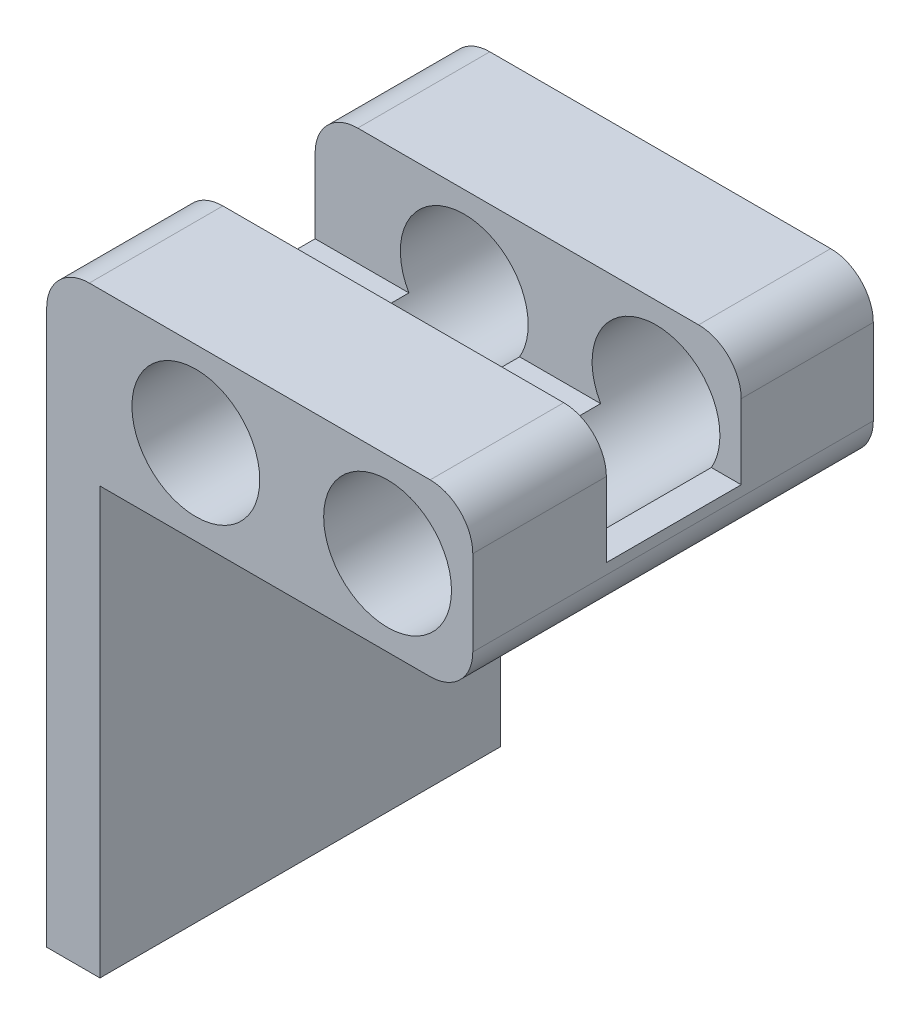
from build123d import *

# Parameters (mm, degrees)
SKETCH1_W               = 23.876
SKETCH1_H               = 25.4
BOSS_EXTRUDE1_DEPTH     = 3.175
SKETCH2_W               = 25.4
SKETCH2_H               = 23.876
BOSS_EXTRUDE2_DEPTH     = 3.175
SKETCH3_W               = 25.4
SKETCH3_H               = 7.9629
SKETCH3_H_2             = 7.874
BOSS_EXTRUDE3_DEPTH     = 6.985
CUT_EXTRUDE1_DEPTH      = 50.796957497
CUT_EXTRUDE1_DEPTH_BACK = 50.796957497
SKETCH4_R               = 3.81
FILLET1_R               = 2.54
FILLET2_R               = 2.54
FILLET3_R               = 2.54


with BuildPart() as part:
    # Sketch1 → Boss-Extrude1 (new body)
    with BuildSketch(Plane(origin=(0, 0, 0), x_dir=(0, 0, -1), z_dir=(1, 0, 0))):
        with Locations((11.938, 12.7)):
            Rectangle(SKETCH1_W, SKETCH1_H)
    extrude(amount=BOSS_EXTRUDE1_DEPTH)

    # Sketch2 → Boss-Extrude2 (add)
    with BuildSketch(Plane(origin=(0, 25.4, 0), x_dir=(1, 0, 0), z_dir=(0, 1, 0))):
        with Locations((12.7, 11.938)):
            Rectangle(SKETCH2_W, SKETCH2_H)
    extrude(amount=BOSS_EXTRUDE2_DEPTH)

    # Sketch3 → Boss-Extrude3 (add)
    with BuildSketch(Plane(origin=(0, 28.575, 0), x_dir=(1, 0, 0), z_dir=(0, 1, 0))):
        with Locations((12.7, 3.98145)):
            Rectangle(SKETCH3_W, SKETCH3_H)
        with Locations((12.7, 19.939)):
            Rectangle(SKETCH3_W, SKETCH3_H_2)
    extrude(amount=BOSS_EXTRUDE3_DEPTH)

    # Sketch4 → Cut-Extrude1 (cut, two sides: drawn at the far end of the back side and taken through both)
    with BuildSketch(Plane.XY.offset(-CUT_EXTRUDE1_DEPTH_BACK)):
        with Locations((8.89, 30.48)):
            Circle(SKETCH4_R)
        with Locations((20.32, 30.48)):
            Circle(SKETCH4_R)
    extrude(amount=CUT_EXTRUDE1_DEPTH + CUT_EXTRUDE1_DEPTH_BACK, mode=Mode.SUBTRACT)

    # Fillet1
    fillet1_edges = [part.edges().sort_by_distance(p)[0] for p in [
        (0, 35.56, -3.98145),
        (0, 35.56, -19.939),
    ]]
    fillet(fillet1_edges, radius=FILLET1_R)

    # Fillet2
    fillet2_edges = [part.edges().sort_by_distance(p)[0] for p in [
        (25.4, 25.4, -11.938),
    ]]
    fillet(fillet2_edges, radius=FILLET2_R)

    # Fillet3
    fillet3_edges = [part.edges().sort_by_distance(p)[0] for p in [
        (25.4, 35.56, -3.98145),
        (25.4, 35.56, -19.939),
    ]]
    fillet(fillet3_edges, radius=FILLET3_R)


solid = part.part
